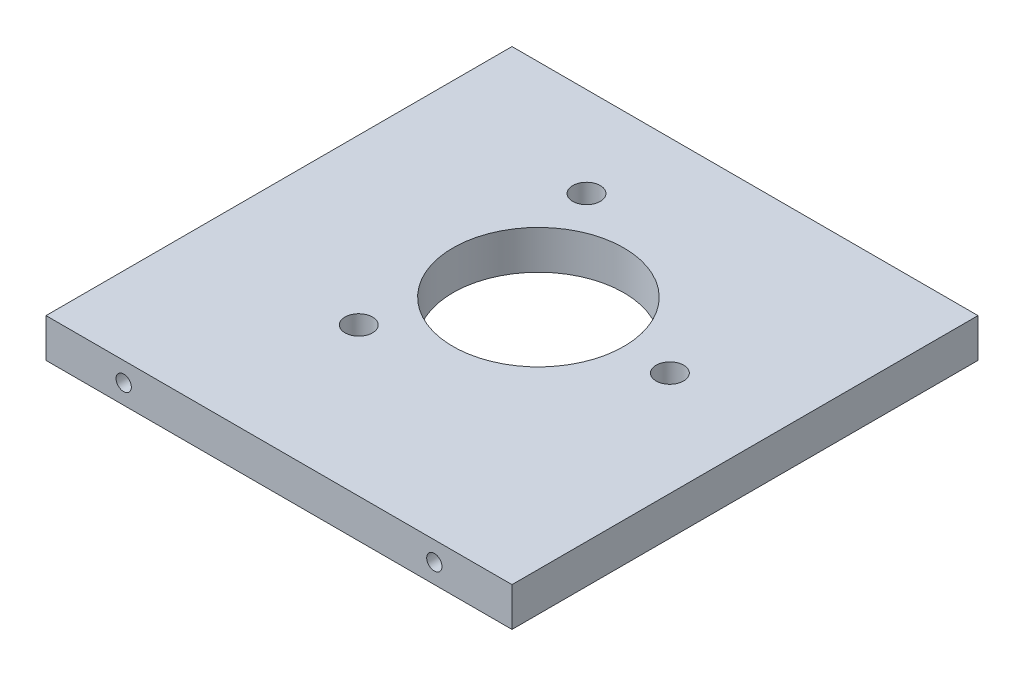
from build123d import *

# Parameters (mm, degrees)
BOSS_EXTRUDE1_DEPTH                             = 76.2
BOSS_EXTRUDE1_DEPTH_BACK                        = 76.2
SKETCH3_W                                       = 76.2
SKETCH3_H                                       = 6.35
SKETCH11_R                                      = 13.97
CUT_EXTRUDE1_DEPTH                              = 86.430512699
CSK_FOR_M4_FLAT_HEAD_MACHINE_SCREW1_D           = 4.5
CSK_FOR_M4_FLAT_HEAD_MACHINE_SCREW1_CSINK_D     = 9.4
CSK_FOR_M4_FLAT_HEAD_MACHINE_SCREW1_CSINK_ANGLE = 90
SKETCH20_W                                      = 76.2
SKETCH20_H                                      = 76.2
CUT_EXTRUDE2_DEPTH                              = 86.430512699
M3X0_5_TAPPED_HOLE3_D                           = 2.5
M3X0_5_TAPPED_HOLE3_DEPTH                       = 11.948924226
M3X0_5_TAPPED_HOLE3_TIP                         = 0.751075774


with BuildPart() as part:
    # Sketch3 → Boss-Extrude1 (new, two sides: drawn at the far end of the back side and taken through both)
    with BuildSketch(Plane.XY.offset(-BOSS_EXTRUDE1_DEPTH_BACK)):
        Rectangle(SKETCH3_W, SKETCH3_H)
    extrude(amount=BOSS_EXTRUDE1_DEPTH + BOSS_EXTRUDE1_DEPTH_BACK)

    # Sketch11 → Cut-Extrude1 (cut, through all)
    with BuildSketch(Plane.XZ.offset(3.175)):
        with Locations(Location((-0.450951641, 33.334066428, 0), (0, 0, 270))):
            Circle(SKETCH11_R)
    extrude(amount=-CUT_EXTRUDE1_DEPTH, mode=Mode.SUBTRACT)

    # CSK for M4 Flat Head Machine Screw1 (through all)
    with Locations(Plane(origin=(0, -3.175, 0), x_dir=(-1, 0, 0), z_dir=(0, -1, 0))):
        with Locations((11.200951641, -14.714520247), (-21.049048359, -33.334066428), (11.200951641, -51.953612609)):
            CounterSinkHole(CSK_FOR_M4_FLAT_HEAD_MACHINE_SCREW1_D / 2, CSK_FOR_M4_FLAT_HEAD_MACHINE_SCREW1_CSINK_D / 2, counter_sink_angle=CSK_FOR_M4_FLAT_HEAD_MACHINE_SCREW1_CSINK_ANGLE)

    # Sketch20 → Cut-Extrude2 (cut, through all)
    with BuildSketch(Plane.XZ.offset(3.175)):
        with Locations((0, -38.1)):
            Rectangle(SKETCH20_W, SKETCH20_H)
    extrude(amount=-CUT_EXTRUDE2_DEPTH, mode=Mode.SUBTRACT)

    # M3x0.5 Tapped Hole3
    with Locations(Plane.XY.offset(76.2)):
        with Locations((25.4, 0), (-25.4, 0)):
            Hole(M3X0_5_TAPPED_HOLE3_D / 2, depth=M3X0_5_TAPPED_HOLE3_DEPTH)
            with Locations((0, 0, -(M3X0_5_TAPPED_HOLE3_DEPTH + M3X0_5_TAPPED_HOLE3_TIP / 2))):  # 118° drill point
                Cone(0, M3X0_5_TAPPED_HOLE3_D / 2, M3X0_5_TAPPED_HOLE3_TIP, mode=Mode.SUBTRACT)


solid = part.part
